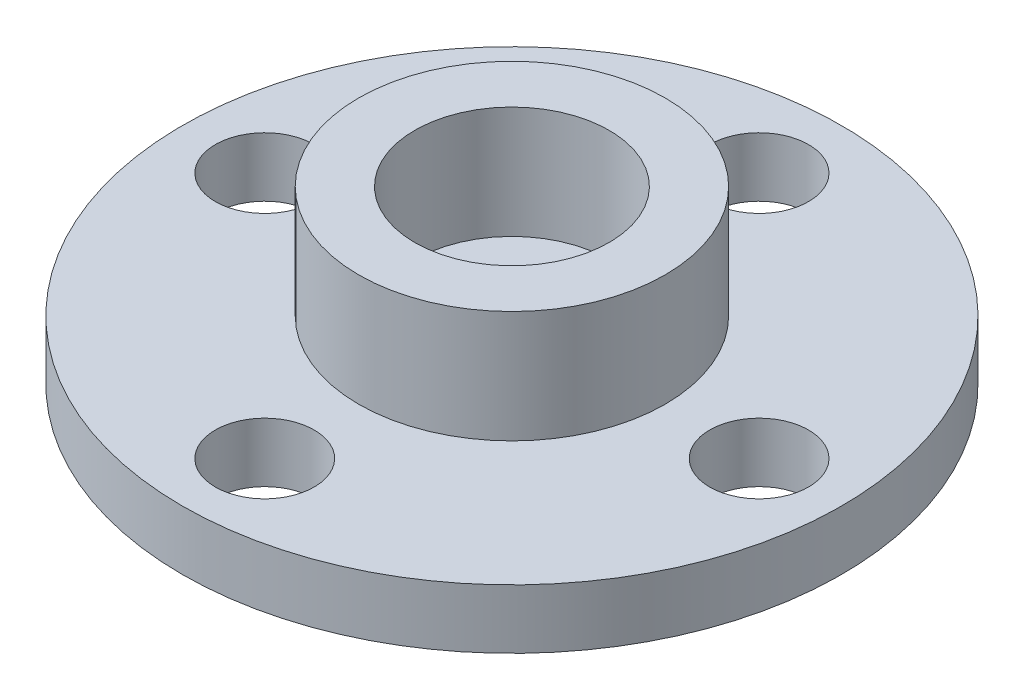
from build123d import *

# Parameters (mm, degrees)
SKETCH1_R           = 10
BOSS_EXTRUDE1_DEPTH = 5.2
CUT_EXTRUDE1_START  = -3.4
SKETCH2_R           = 10
SKETCH2_R_2         = 4.65
CUT_EXTRUDE1_DEPTH  = 3.4
CUT_EXTRUDE2_REACH  = 16.545
SKETCH3_R           = 1.5
SKETCH4_R           = 2.95
CUT_EXTRUDE3_DEPTH  = 3.4


with BuildPart() as part:
    # Sketch1 → Boss-Extrude1 (new body)
    with BuildSketch(Plane(origin=(0, 0, 0), x_dir=(1, 0, 0), z_dir=(0, 1, 0))):
        with Locations(Location((0, 0, 0), (0, 0, 270))):
            Circle(SKETCH1_R)
    extrude(amount=BOSS_EXTRUDE1_DEPTH)

    # Sketch2 → Cut-Extrude1 (cut)
    with BuildSketch(Plane(origin=(0, 5.2, 0), x_dir=(1, 0, 0), z_dir=(0, 1, 0)).offset(CUT_EXTRUDE1_START)):
        with Locations(Location((0, 0, 0), (0, 0, 270))):
            Circle(SKETCH2_R)
        with Locations(Location((0, 0, 0), (0, 0, 270))):
            Circle(SKETCH2_R_2, mode=Mode.SUBTRACT)
    extrude(amount=CUT_EXTRUDE1_DEPTH, mode=Mode.SUBTRACT)

    # Sketch3 → Cut-Extrude2 (cut, up to next)
    with BuildSketch(Plane(origin=(0, 1.8, 0), x_dir=(1, 0, 0), z_dir=(0, 1, 0)), mode=Mode.PRIVATE) as cut_extrude2_sk1:
        with Locations(Location((0, 0, 0), (0, 0, 270))):
            Circle(SKETCH3_R)
    cut_extrude2_tool1 = extrude(cut_extrude2_sk1.sketch, amount=-CUT_EXTRUDE2_REACH, mode=Mode.PRIVATE) & part.part
    # Sketch3 → Cut-Extrude2 (cut, up to next)
    with BuildSketch(Plane(origin=(0, 1.8, 0), x_dir=(1, 0, 0), z_dir=(0, 1, 0)), mode=Mode.PRIVATE) as cut_extrude2_sk2:
        with Locations(Location((-7.5, 0, 0), (0, 0, 270))):
            Circle(SKETCH3_R)
    cut_extrude2_tool2 = extrude(cut_extrude2_sk2.sketch, amount=-CUT_EXTRUDE2_REACH, mode=Mode.PRIVATE) & part.part
    # Sketch3 → Cut-Extrude2 (cut, up to next)
    with BuildSketch(Plane(origin=(0, 1.8, 0), x_dir=(1, 0, 0), z_dir=(0, 1, 0)), mode=Mode.PRIVATE) as cut_extrude2_sk3:
        with Locations(Location((0, 7.5, 0), (0, 0, 270))):
            Circle(SKETCH3_R)
    cut_extrude2_tool3 = extrude(cut_extrude2_sk3.sketch, amount=-CUT_EXTRUDE2_REACH, mode=Mode.PRIVATE) & part.part
    # Sketch3 → Cut-Extrude2 (cut, up to next)
    with BuildSketch(Plane(origin=(0, 1.8, 0), x_dir=(1, 0, 0), z_dir=(0, 1, 0)), mode=Mode.PRIVATE) as cut_extrude2_sk4:
        with Locations(Location((7.5, 0, 0), (0, 0, 270))):
            Circle(SKETCH3_R)
    cut_extrude2_tool4 = extrude(cut_extrude2_sk4.sketch, amount=-CUT_EXTRUDE2_REACH, mode=Mode.PRIVATE) & part.part
    # Sketch3 → Cut-Extrude2 (cut, up to next)
    with BuildSketch(Plane(origin=(0, 1.8, 0), x_dir=(1, 0, 0), z_dir=(0, 1, 0)), mode=Mode.PRIVATE) as cut_extrude2_sk5:
        with Locations(Location((0, -7.5, 0), (0, 0, 270))):
            Circle(SKETCH3_R)
    cut_extrude2_tool5 = extrude(cut_extrude2_sk5.sketch, amount=-CUT_EXTRUDE2_REACH, mode=Mode.PRIVATE) & part.part
    add(cut_extrude2_tool1.solids().sort_by_distance((0, 1.8, 0))[0], mode=Mode.SUBTRACT)
    add(cut_extrude2_tool2.solids().sort_by_distance((-7.5, 1.8, 0))[0], mode=Mode.SUBTRACT)
    add(cut_extrude2_tool3.solids().sort_by_distance((0, 1.8, -7.5))[0], mode=Mode.SUBTRACT)
    add(cut_extrude2_tool4.solids().sort_by_distance((7.5, 1.8, 0))[0], mode=Mode.SUBTRACT)
    add(cut_extrude2_tool5.solids().sort_by_distance((0, 1.8, 7.5))[0], mode=Mode.SUBTRACT)

    # Sketch4 → Cut-Extrude3 (cut)
    with BuildSketch(Plane(origin=(0, 5.2, 0), x_dir=(1, 0, 0), z_dir=(0, 1, 0))):
        with Locations(Location((0, 0, 0), (0, 0, 270))):
            Circle(SKETCH4_R)
    extrude(amount=-CUT_EXTRUDE3_DEPTH, mode=Mode.SUBTRACT)


solid = part.part
